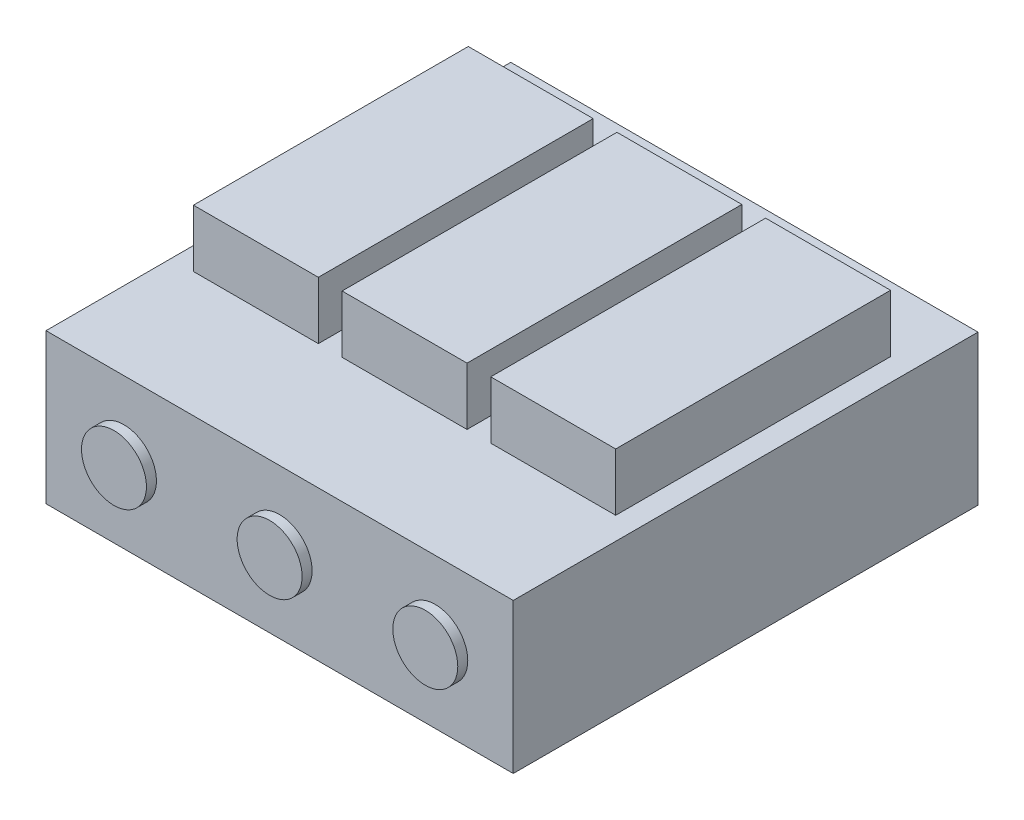
from build123d import *

# Parameters (mm, degrees)
SK_HOUSING_W         = 18.7
SK_HOUSING_H         = 18.6
HOUSING_DEPTH        = 6
LEVERS_START         = 6
SK_LEVERS_W          = 5
SK_LEVERS_H          = 11
LEVERS_DEPTH         = 2.3
LEVERS_2_DEPTH       = 2.3
LEVERS_3_DEPTH       = 2.3
SK_WIRE_ENTRIES_R    = 1.3
WIRE_ENTRIES_DEPTH   = 0.4
WIRE_ENTRIES_2_DEPTH = 0.4
WIRE_ENTRIES_3_DEPTH = 0.4


with BuildPart() as part:
    # SK Housing → Housing (new body)
    with BuildSketch(Plane(origin=(0, 0, 0), x_dir=(1, 0, 0), z_dir=(0, 1, 0))):
        with Locations((9.35, 9.3)):
            Rectangle(SK_HOUSING_W, SK_HOUSING_H)
    extrude(amount=HOUSING_DEPTH)


with BuildPart() as body_2:
    # SK Levers → Levers (new body)
    with BuildSketch(Plane(origin=(0, 0, 0), x_dir=(1, 0, 0), z_dir=(0, 1, 0)).offset(LEVERS_START)):
        with Locations((3.4, 10.5)):
            Rectangle(SK_LEVERS_W, SK_LEVERS_H)
    extrude(amount=LEVERS_DEPTH)


with BuildPart() as body_3:
    # SK Levers → Levers 2 (new body)
    with BuildSketch(Plane(origin=(0, 0, 0), x_dir=(1, 0, 0), z_dir=(0, 1, 0)).offset(LEVERS_START)):
        with Locations((9.35, 10.5)):
            Rectangle(SK_LEVERS_W, SK_LEVERS_H)
    extrude(amount=LEVERS_2_DEPTH)


with BuildPart() as body_4:
    # SK Levers → Levers 3 (new body)
    with BuildSketch(Plane(origin=(0, 0, 0), x_dir=(1, 0, 0), z_dir=(0, 1, 0)).offset(LEVERS_START)):
        with Locations((15.3, 10.5)):
            Rectangle(SK_LEVERS_W, SK_LEVERS_H)
    extrude(amount=LEVERS_3_DEPTH)


with BuildPart() as body_5:
    # SK Wire entries → Wire entries (new body)
    with BuildSketch(Plane.XY):
        with Locations((3.12, 3)):
            Circle(SK_WIRE_ENTRIES_R)
    extrude(amount=WIRE_ENTRIES_DEPTH)


with BuildPart() as body_6:
    # SK Wire entries → Wire entries 2 (new body)
    with BuildSketch(Plane.XY):
        with Locations((9.35, 3)):
            Circle(SK_WIRE_ENTRIES_R)
    extrude(amount=WIRE_ENTRIES_2_DEPTH)


with BuildPart() as body_7:
    # SK Wire entries → Wire entries 3 (new body)
    with BuildSketch(Plane.XY):
        with Locations((15.58, 3)):
            Circle(SK_WIRE_ENTRIES_R)
    extrude(amount=WIRE_ENTRIES_3_DEPTH)


solid = Compound([part.part, body_2.part, body_3.part, body_4.part, body_5.part, body_6.part, body_7.part])
